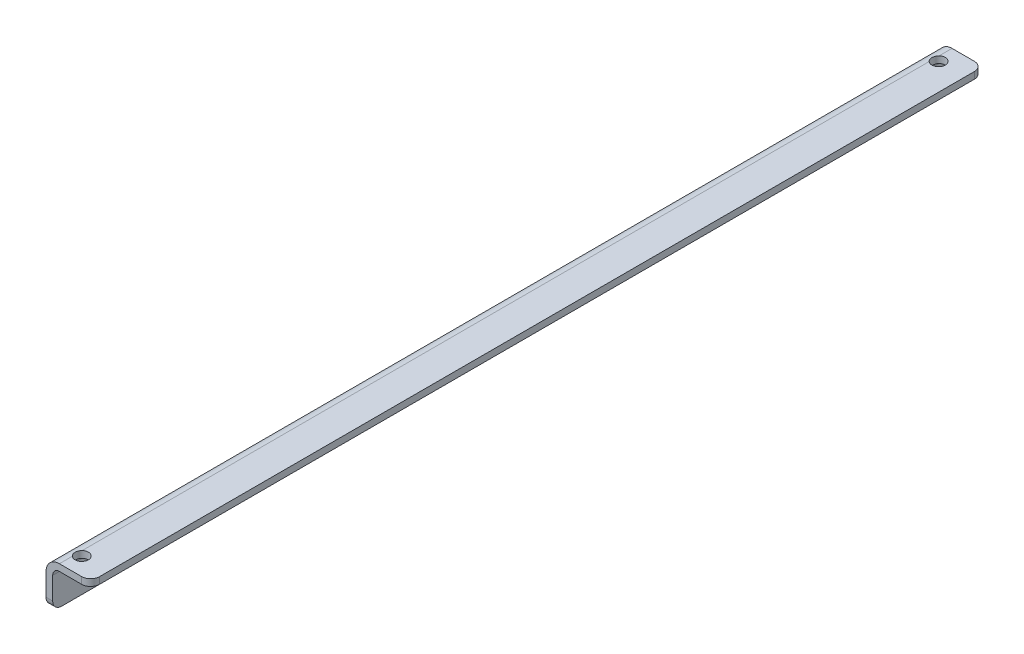
from build123d import *

# Parameters (mm, degrees)
EXTRUDE_1_DEPTH     = 200
SKETCH_2_R          = 1.5
SKETCH_2_R_2        = 0.95
CUT_EXTRUDE_1_DEPTH = 5
FILLET_1_R          = 2


with BuildPart() as part:
    # Эскиз1 → Вытянуть1 (new body)
    with BuildSketch(Plane.XY):
        with BuildLine():
            Line((0, 0), (1.5, 0))
            Line((1.5, 0), (1.5, 7))
            ThreePointArc((1.5, 7), (1.939339828, 8.060660172), (3, 8.5))
            Line((3, 8.5), (10, 8.5))
            Line((10, 8.5), (10, 10))
            Line((10, 10), (3, 10))
            ThreePointArc((3, 10), (0.878679656, 9.121320344), (0, 7))
            Line((0, 7), (0, 0))
        make_face()
    extrude(amount=EXTRUDE_1_DEPTH)

    # Эскиз2 → Вырез-Вытянуть1 (cut)
    with BuildSketch(Plane(origin=(0, 10, 0), x_dir=(-1, 0, 0), z_dir=(0, 1, 0))):
        with Locations(Location((-4, 196, 0), (0, 0, 48.189685104))):
            Circle(SKETCH_2_R)
        with Locations(Location((-4, 4, 0), (0, 0, 48.189685104))):
            Circle(SKETCH_2_R)
        with Locations((-4, -88)):
            Circle(SKETCH_2_R_2)
    extrude(amount=-CUT_EXTRUDE_1_DEPTH, mode=Mode.SUBTRACT)

    # Скругление1
    fillet_1_edges = [part.edges().sort_by_distance(p)[0] for p in [
        (10, 9.25, 200),
        (0.75, 0, 200),
        (10, 9.25, 0),
        (0.75, 0, 0),
    ]]
    fillet(fillet_1_edges, radius=FILLET_1_R)


solid = part.part
